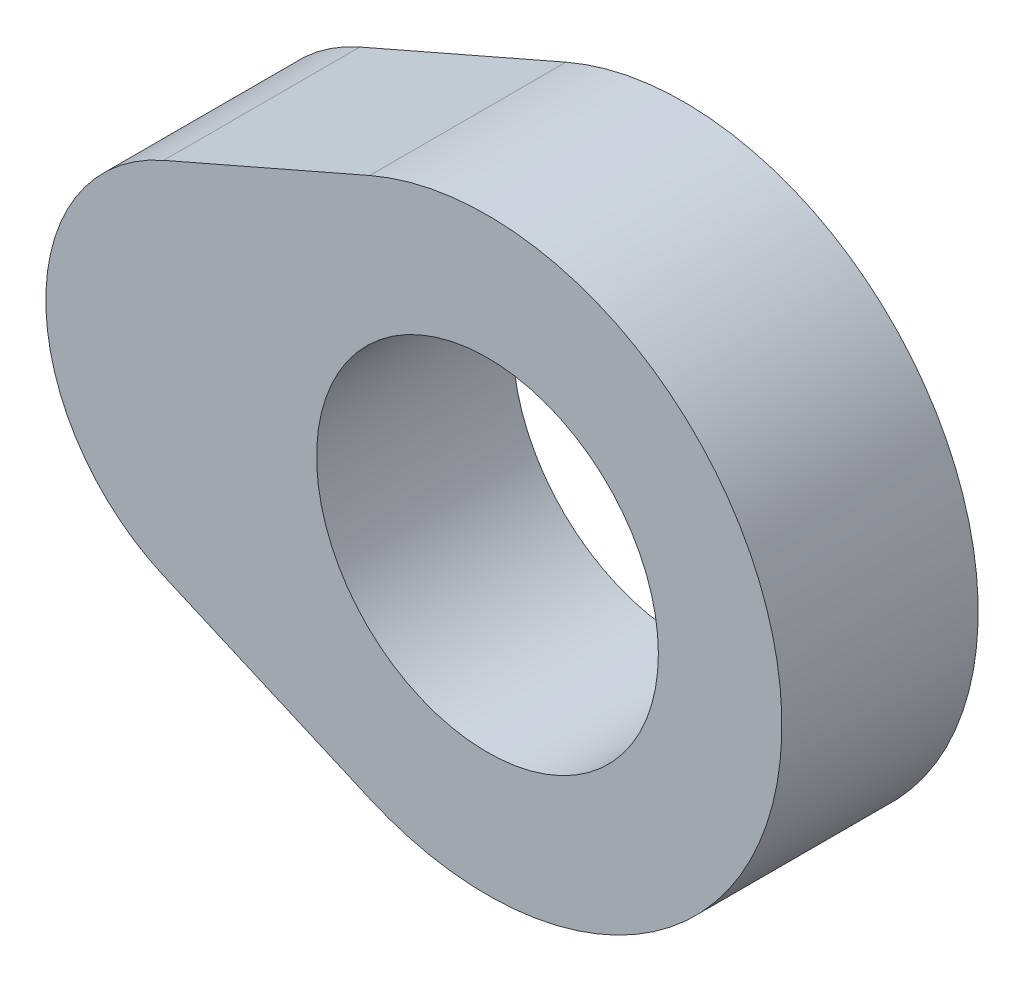
from build123d import *

# Parameters (mm, degrees)
SKETCH1_R           = 34.823570188
BOSS_EXTRUDE1_DEPTH = 20


with BuildPart() as part:
    # Sketch1 → Boss-Extrude1 (new, symmetric)
    with BuildSketch(Plane.XY):
        with BuildLine():
            Line((-66, 36.66060556), (-24, 54.990908339))
            ThreePointArc((-24, 54.990908339), (60, 0), (-24, -54.990908339))
            Line((-24, -54.990908339), (-66, -36.66060556))
            ThreePointArc((-66, -36.66060556), (-90, 0), (-66, 36.66060556))
        make_face()
        Circle(SKETCH1_R, mode=Mode.SUBTRACT)
    extrude(amount=BOSS_EXTRUDE1_DEPTH, both=True)


solid = part.part
